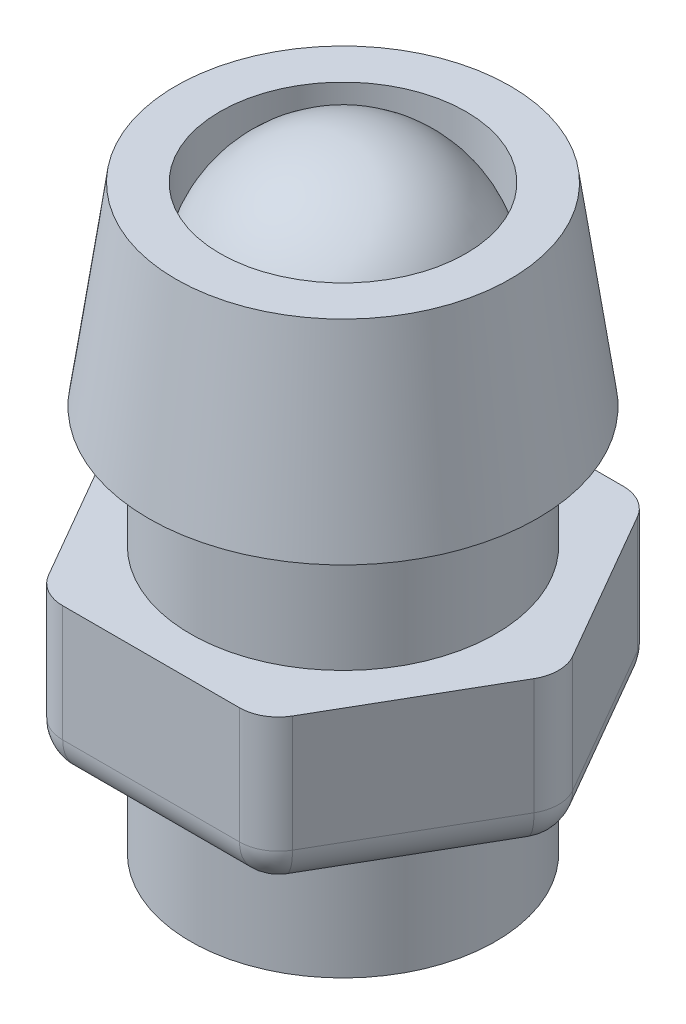
from build123d import *

# Parameters (mm, degrees)
SKETCH2_R           = 3.175
CUT_EXTRUDE1_DEPTH  = 17.595630172
BOSS_EXTRUDE1_DEPTH = 4
FILLET1_R           = 1
FILLET2_R           = 1


with BuildPart() as part:
    # Sketch1 → Revolve1 (revolve)
    with BuildSketch(Plane.XY, mode=Mode.PRIVATE) as revolve1_sk:
        Polygon((0, 0), (0, 15), (4.318, 15), (5.020704174, 10), (3.937, 10), (3.937, 0), align=None)
    revolve(revolve1_sk.sketch.rotate(Axis((0, 0, 0), (0, 1, 0)), 90), axis=Axis((0, 0, 0), (0, 1, 0)))

    # Sketch2 → Cut-Extrude1 (cut, through all)
    with BuildSketch(Plane(origin=(0, 15, 0), x_dir=(1, 0, 0), z_dir=(0, 1, 0))):
        with Locations(Location((0, 0, 0), (0, 0, 270))):
            Circle(SKETCH2_R)
    extrude(amount=-CUT_EXTRUDE1_DEPTH, mode=Mode.SUBTRACT)

    # Sketch4 → Boss-Extrude1 (add)
    with BuildSketch(Plane(origin=(0, 6.875, 0), x_dir=(-1, 0, 0), z_dir=(0, -1, 0))):
        Polygon((5.719231767, 0), (2.859615883, 4.953), (-2.859615883, 4.953), (-5.719231767, 0), (-2.859615883, -4.953), (2.859615883, -4.953), align=None)
    extrude(amount=BOSS_EXTRUDE1_DEPTH)

    # Fillet1
    fillet1_edges = [part.edges().sort_by_distance(p)[0] for p in [
        (-2.859615883, 4.875, 4.953),
        (-5.719231767, 4.875, 0),
        (-2.859615883, 4.875, -4.953),
        (2.859615883, 4.875, -4.953),
        (5.719231767, 4.875, 0),
        (2.859615883, 4.875, 4.953),
    ]]
    fillet(fillet1_edges, radius=FILLET1_R)

    # Fillet2
    fillet2_edges = [part.edges().sort_by_distance(p)[0] for p in [
        (4.289423825, 2.875, 2.4765),
        (4.289423825, 2.875, -2.4765),
        (-4.289423825, 2.875, 2.4765),
        (-4.289423825, 2.875, -2.4765),
        (0, 2.875, -4.953),
        (0, 2.875, 4.953),
        (2.782265614, 2.875, 4.819025404),
        (-2.782265614, 2.875, 4.819025404),
        (-5.564531228, 2.875, 0),
        (-2.782265614, 2.875, -4.819025404),
        (2.782265614, 2.875, -4.819025404),
        (5.564531228, 2.875, 0),
    ]]
    fillet(fillet2_edges, radius=FILLET2_R)


with BuildPart() as body_2:
    # Sketch3 → Revolve2 (revolve)
    with BuildSketch(Plane.XY):
        with BuildLine():
            Line((0, 16), (0, 13.599652711))
            Line((0, 13.599652711), (3.175, 13.599652711))
            ThreePointArc((3.175, 13.599652711), (1.990118848, 15.332380476), (0, 16))
        make_face()
    revolve(axis=Axis((0, 0, 0), (0, 1, 0)))


solid = Compound([part.part, body_2.part])
